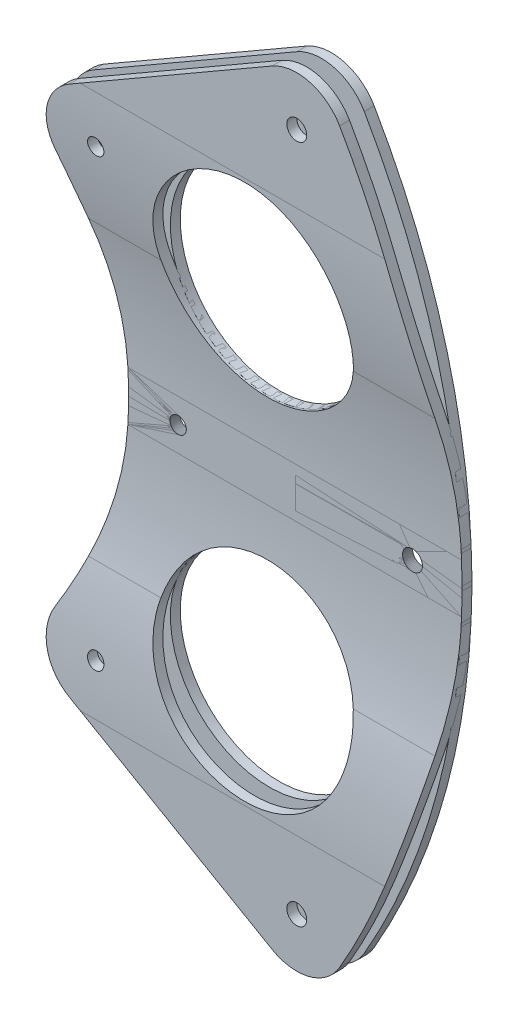
from build123d import *

# Parameters (mm, degrees)
SKETCH1_R               = 2.5527
SKETCH1_R_2             = 2.0955
BOSS_EXTRUDE1_DEPTH     = 2.54
CUT_EXTRUDE1_DEPTH      = 215.348124344
CUT_EXTRUDE1_DEPTH_BACK = 215.348124344
SKETCH2_R               = 25.4
BOSS_EXTRUDE2_DEPTH     = 276.098
SKETCH1_2_OUTSIDE_W     = 347.428
SKETCH1_2_OUTSIDE_H     = 280.754
SKETCH1_2_OUTSIDE_R     = 2.5527
SKETCH1_2_OUTSIDE_R_2   = 2.0955
CUT_EXTRUDE3_DEPTH      = 276.098
FILLET1_R               = 12.7
FILLET2_R               = 12.7
CUT_EXTRUDE4_DEPTH      = 213.304536795
CUT_EXTRUDE4_DEPTH_BACK = 213.304536795
SKETCH2_2_R             = 25.4


with BuildPart() as part:
    # Sketch1 → Boss-Extrude1 (new body)
    with BuildSketch(Plane.XY):
        with BuildLine():
            Line((155.394709042, 104.381873933), (80.948066989, 61.400085104))
            ThreePointArc((80.948066989, 61.400085104), (101.6, 0), (80.948066989, -61.400085104))
            Line((80.948066989, -61.400085104), (155.394709042, -104.381873933))
            ThreePointArc((155.394709042, -104.381873933), (187.198, 0), (155.394709042, 104.381873933))
        make_face()
        with Locations((174.498, 0)):
            Circle(SKETCH1_R, mode=Mode.SUBTRACT)
        with Locations((151.11970091, 87.249)):
            Circle(SKETCH1_R, mode=Mode.SUBTRACT)
        with Locations((151.11970091, -87.249)):
            Circle(SKETCH1_R, mode=Mode.SUBTRACT)
        with Locations((98.986703653, 57.15)):
            Circle(SKETCH1_R_2, mode=Mode.SUBTRACT)
        with Locations((114.3, 0)):
            Circle(SKETCH1_R_2, mode=Mode.SUBTRACT)
        with Locations((98.986703653, -57.15)):
            Circle(SKETCH1_R_2, mode=Mode.SUBTRACT)
    extrude(amount=BOSS_EXTRUDE1_DEPTH)

    # Sketch2 → Cut-Extrude1 (cut, two sides: drawn at the far end of the back side and taken through both)
    with BuildSketch(Plane.XY.offset(2.54).offset(-CUT_EXTRUDE1_DEPTH_BACK)):
        with Locations((137.698969318, 43.474878375)):
            Circle(SKETCH2_R)
        with Locations((137.698969318, -43.474878375)):
            Circle(SKETCH2_R)
    extrude(amount=CUT_EXTRUDE1_DEPTH + CUT_EXTRUDE1_DEPTH_BACK, mode=Mode.SUBTRACT)

    # Fillet1
    fillet1_edges = [part.edges().sort_by_distance(p)[0] for p in [
        (155.394709042, 104.381873933, 1.27),
        (80.948066989, 61.400085104, 1.27),
        (155.394709042, -104.381873933, 1.27),
        (80.948066989, -61.400085104, 1.27),
    ]]
    fillet(fillet1_edges, radius=FILLET1_R)


with BuildPart() as body_2:
    # Sketch3 → Boss-Extrude2 (new body)
    with BuildSketch(Plane(origin=(0, 0, 0), x_dir=(0, 0, -1), z_dir=(1, 0, 0))):
        with BuildLine():
            Line((0, 6.35), (0, -6.35))
            ThreePointArc((0, -6.35), (-0.79572845, -22.288381411), (-3.175, -38.06825))
            ThreePointArc((-3.175, -38.06825), (-5.55427155, -53.848118589), (-6.35, -69.7865))
            Line((-6.35, -69.7865), (-6.35, -104.7115))
            Line((-6.35, -104.7115), (-8.89, -104.7115))
            Line((-8.89, -104.7115), (-8.89, -69.7865))
            ThreePointArc((-8.89, -69.7865), (-8.081640952, -53.595128658), (-5.664603225, -37.564786214))
            ThreePointArc((-5.664603225, -37.564786214), (-3.323097852, -22.035391481), (-2.54, -6.35))
            Line((-2.54, -6.35), (-2.54, 6.35))
            ThreePointArc((-2.54, 6.35), (-3.323097852, 22.035391481), (-5.664603225, 37.564786214))
            ThreePointArc((-5.664603225, 37.564786214), (-8.081640952, 53.595128658), (-8.89, 69.7865))
            Line((-8.89, 69.7865), (-8.89, 104.7115))
            Line((-8.89, 104.7115), (-6.35, 104.7115))
            Line((-6.35, 104.7115), (-6.35, 69.7865))
            ThreePointArc((-6.35, 69.7865), (-5.55427155, 53.848118589), (-3.175, 38.06825))
            ThreePointArc((-3.175, 38.06825), (-0.79572845, 22.288381411), (0, 6.35))
        make_face()
    extrude(amount=BOSS_EXTRUDE2_DEPTH)

    # Sketch1<2> outside → Cut-Extrude3 (cut)
    # profile 1 of 7: a face of its own
    with BuildSketch(Plane.XY):
        with Locations((138.049, 0)):
            Rectangle(SKETCH1_2_OUTSIDE_W, SKETCH1_2_OUTSIDE_H)
        with BuildLine():
            Line((155.394709042, 104.381873933), (80.948066989, 61.400085104))
            ThreePointArc((80.948066989, 61.400085104), (101.6, 0), (80.948066989, -61.400085104))
            Line((80.948066989, -61.400085104), (155.394709042, -104.381873933))
            ThreePointArc((155.394709042, -104.381873933), (187.198, 0), (155.394709042, 104.381873933))
        make_face(mode=Mode.SUBTRACT)
    # profile 2 of 7: a face of its own
    with BuildSketch(Plane.XY):
        with Locations((174.498, 0)):
            Circle(SKETCH1_2_OUTSIDE_R)
    # profile 3 of 7: a face of its own
    with BuildSketch(Plane.XY):
        with Locations((151.11970091, 87.249)):
            Circle(SKETCH1_2_OUTSIDE_R)
    # profile 4 of 7: a face of its own
    with BuildSketch(Plane.XY):
        with Locations((151.11970091, -87.249)):
            Circle(SKETCH1_2_OUTSIDE_R)
    # profile 5 of 7: a face of its own
    with BuildSketch(Plane.XY):
        with Locations((98.986703653, 57.15)):
            Circle(SKETCH1_2_OUTSIDE_R_2)
    # profile 6 of 7: a face of its own
    with BuildSketch(Plane.XY):
        with Locations((114.3, 0)):
            Circle(SKETCH1_2_OUTSIDE_R_2)
    # profile 7 of 7: a face of its own
    with BuildSketch(Plane.XY):
        with Locations((98.986703653, -57.15)):
            Circle(SKETCH1_2_OUTSIDE_R_2)
    extrude(amount=CUT_EXTRUDE3_DEPTH, mode=Mode.SUBTRACT)

    # Fillet2
    fillet2_edges = [body_2.edges().sort_by_distance(p)[0] for p in [
        (155.394709042, -104.381873933, 7.62),
        (80.948066989, -61.400085104, 7.401809581),
        (80.948066989, 61.400085104, 7.401809581),
        (155.394709042, 104.381873933, 7.62),
    ]]
    fillet(fillet2_edges, radius=FILLET2_R)

    # Sketch2<2> → Cut-Extrude4 (cut, two sides: drawn at the far end of the back side and taken through both)
    with BuildSketch(Plane.XY.offset(2.54).offset(-CUT_EXTRUDE4_DEPTH_BACK)):
        with Locations((137.698969318, 43.474878375)):
            Circle(SKETCH2_2_R)
        with Locations((137.698969318, -43.474878375)):
            Circle(SKETCH2_2_R)
    extrude(amount=CUT_EXTRUDE4_DEPTH + CUT_EXTRUDE4_DEPTH_BACK, mode=Mode.SUBTRACT)


solid = Compound([part.part, body_2.part])
